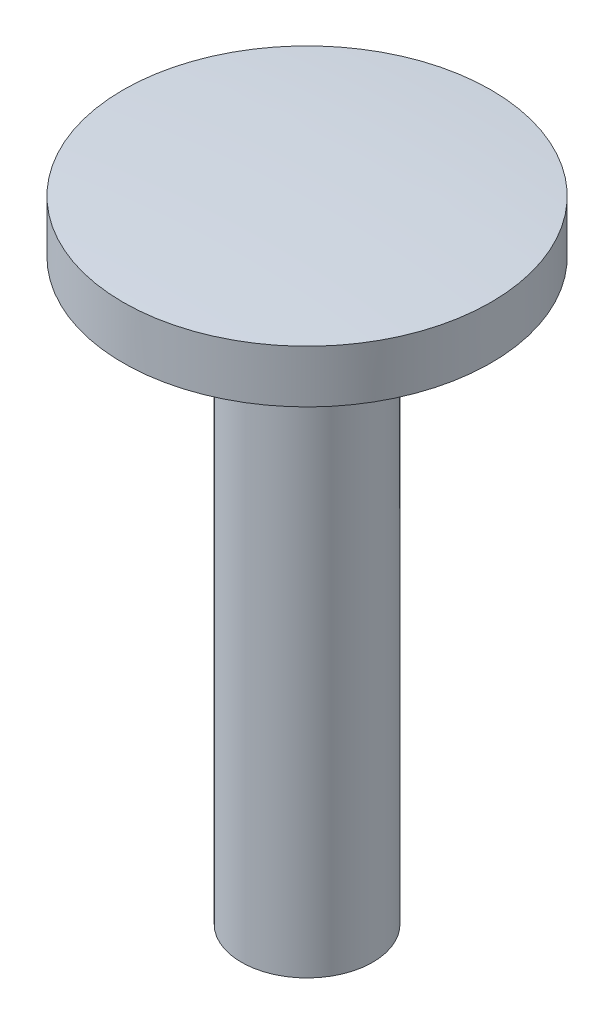
from build123d import *


with BuildPart() as part:
    # Sketch2 → Revolve1 (revolve)
    with BuildSketch(Plane(origin=(0, 0, 0), x_dir=(0, 0, -1), z_dir=(1, 0, 0)), mode=Mode.PRIVATE) as revolve1_sk:
        with BuildLine():
            Line((0, 0), (-2.5, 0))
            Line((-2.5, 0), (-2.5, 20))
            ThreePointArc((-2.5, 20), (-3.085786438, 21.414213562), (-4.5, 22))
            Line((-4.5, 22), (-7, 22))
            Line((-7, 22), (-7, 24))
            ThreePointArc((-7, 24), (-3.502418615, 24.195185991), (0, 24.260277954))
            Line((0, 24.260277954), (0, 0))
        make_face()
    revolve(revolve1_sk.sketch.rotate(Axis((0, 0, 0), (0, 1, 0)), 180), axis=Axis((0, 0, 0), (0, 1, 0)))


solid = part.part
